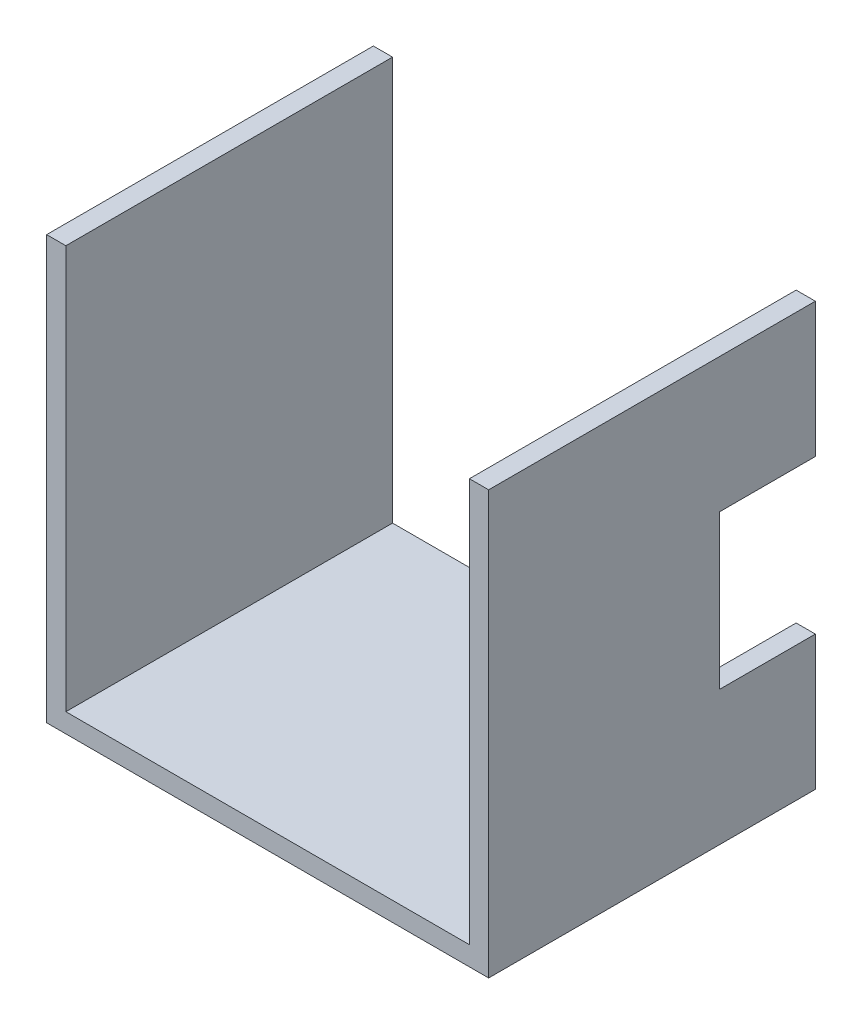
from build123d import *

# Parameters (mm, degrees)
EXTRUDE_1_DEPTH     = 34
SKETCH_2_W          = 10
SKETCH_2_H          = 16
CUT_EXTRUDE_1_DEPTH = 2


with BuildPart() as part:
    # 草图1 → 凸台-拉伸1 (new body)
    with BuildSketch(Plane.XY):
        Polygon((0, 42), (-2, 42), (-2, -2), (44, -2), (44, 42), (42, 42), (42, 0), (0, 0), align=None)
    extrude(amount=EXTRUDE_1_DEPTH)

    # 草图2 → 切除-拉伸1 (cut)
    with BuildSketch(Plane(origin=(44, 0, 0), x_dir=(0, 0, -1), z_dir=(1, 0, 0))):
        with Locations((-5, 20)):
            Rectangle(SKETCH_2_W, SKETCH_2_H)
    extrude(amount=-CUT_EXTRUDE_1_DEPTH, mode=Mode.SUBTRACT)


solid = part.part
